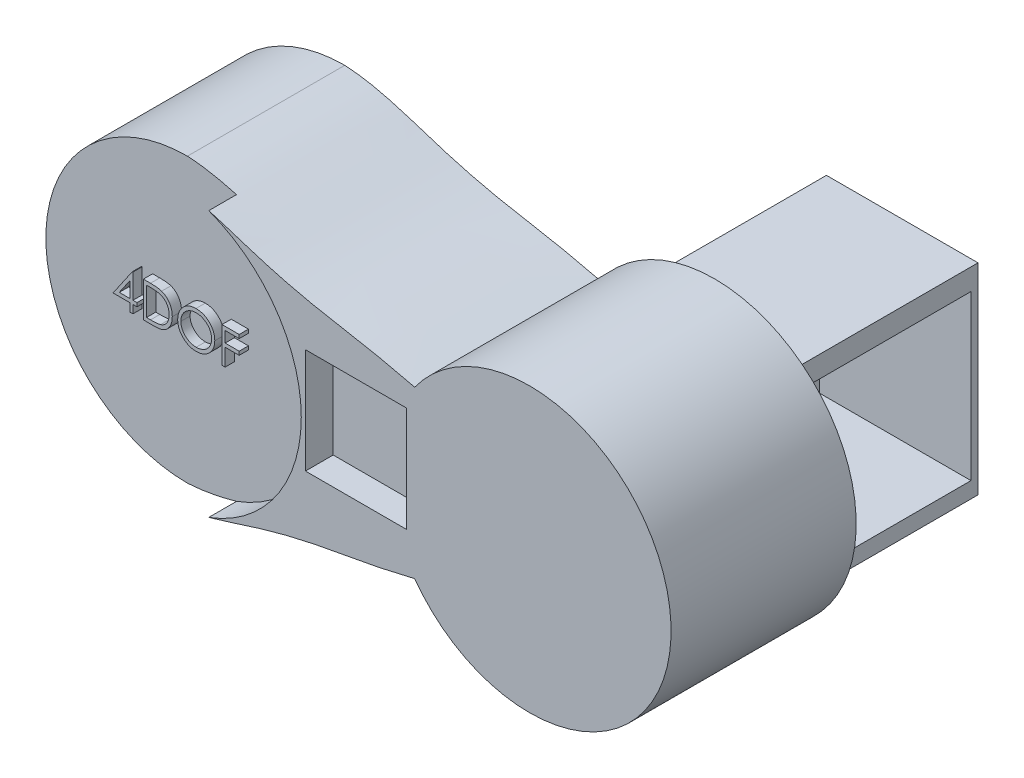
from build123d import *

# Parameters (mm, degrees)
BOSS_EXTRUDE1_DEPTH = 100
CUT_EXTRUDE1_DEPTH  = 39
CUT_EXTRUDE2_DEPTH  = 39
CUT_EXTRUDE3_START  = -15
SKETCH4_R           = 76.495
CUT_EXTRUDE3_DEPTH  = 15
SKETCH5_W           = 54.638275271
SKETCH5_H           = 56.789388471
CUT_EXTRUDE4_DEPTH  = 15
FILLET4_R           = 10
SKETCH6_R           = 74.995169826
CUT_EXTRUDE5_DEPTH  = 39
BOSS_EXTRUDE2_DEPTH = 5
SKETCH8_W           = 81.869075924
SKETCH8_H           = 108.586115143
BOSS_EXTRUDE4_DEPTH = 95
SKETCH10_W          = 89.27039146
SKETCH10_H          = 88.452515612
CUT_EXTRUDE6_DEPTH  = 95
SKETCH11_R          = 5
BOSS_EXTRUDE5_DEPTH = 19
FILLET9_R           = 2
SKETCH12_W          = 89.27039146
SKETCH12_H          = 88.452515612
BOSS_EXTRUDE6_DEPTH = 5


with BuildPart() as part:
    # Sketch1 → Boss-Extrude1 (new body)
    with BuildSketch(Plane.XY):
        with BuildLine():
            ThreePointArc((0, 76.495), (-76.495, 0), (0, -76.495))
            add(Edge.make_bspline(
                [(0, -76.495), (18.845842649, -75.533581637), (46.07453922, -64.621127946), (86.232484293, -54.666992553), (114.479970356, -50.46710642), (132.028881686, -46.045929846), (137.759808345, -44.793841614)],
                knots=[0, 0, 0, 0, 0.273220276, 0.42957721, 0.608078275, 0.694263811, 0.694263811, 0.694263811, 0.694263811], degree=3))
            ThreePointArc((137.759808345, -44.793841614), (276.26284636, 0), (137.759808345, 44.793841614))
            add(Edge.make_bspline(
                [(0, 76.495), (18.845842649, 75.533581637), (46.07453922, 64.621127946), (86.232484293, 54.666992553), (114.479970356, 50.46710642), (132.028881686, 46.045929846), (137.759808345, 44.793841614)],
                knots=[0, 0, 0, 0, 0.273220276, 0.42957721, 0.608078275, 0.694263811, 0.694263811, 0.694263811, 0.694263811], degree=3))
        make_face()
    extrude(amount=BOSS_EXTRUDE1_DEPTH)

    # Sketch2 → Cut-Extrude1 (cut)
    with BuildSketch(Plane(origin=(0, 0, 0), x_dir=(-1, 0, 0), z_dir=(0, 0, -1))):
        Polygon((43.794178302, 54.250712275), (42.68497286, -31.742134307), (-43.307873722, -30.632928864), (-42.19866828, 55.359917718), align=None)
    extrude(amount=-CUT_EXTRUDE1_DEPTH, mode=Mode.SUBTRACT)

    # Sketch3 → Cut-Extrude2 (cut)
    with BuildSketch(Plane(origin=(0, 0, 39), x_dir=(-1, 0, 0), z_dir=(0, 0, -1))):
        with BuildLine():
            Line((6.136565093, 14.54253264), (10.031864242, 14.637529152))
            Line((10.031864242, 14.637529152), (10.153765373, 9.639015362))
            Line((10.153765373, 9.639015362), (6.258466225, 9.54401885))
            ThreePointArc((6.258466225, 9.54401885), (-6.377692603, 11.736598164), (6.136565093, 14.54253264))
        make_face()
    extrude(amount=-CUT_EXTRUDE2_DEPTH, mode=Mode.SUBTRACT)

    # Sketch4 → Cut-Extrude3 (cut)
    with BuildSketch(Plane.XY.offset(100).offset(CUT_EXTRUDE3_START)):
        Circle(SKETCH4_R)
    extrude(amount=CUT_EXTRUDE3_DEPTH, mode=Mode.SUBTRACT)

    # Sketch5 → Cut-Extrude4 (cut)
    with BuildSketch(Plane.XY.offset(100)):
        with Locations((106.056840553, 4.43582867)):
            Rectangle(SKETCH5_W, SKETCH5_H)
    extrude(amount=-CUT_EXTRUDE4_DEPTH, mode=Mode.SUBTRACT)

    # Fillet4
    fillet4_edges = [part.edges().sort_by_distance(p)[0] for p in [
        (133.375978188, 4.435828671, 85),
    ]]
    fillet(fillet4_edges, radius=FILLET4_R)

    # Sketch6 → Cut-Extrude5 (cut)
    with BuildSketch(Plane(origin=(0, 0, 39), x_dir=(-1, 0, 0), z_dir=(0, 0, -1))):
        Circle(SKETCH6_R)
    extrude(amount=CUT_EXTRUDE5_DEPTH, mode=Mode.SUBTRACT)

    # Sketch7 → Boss-Extrude2 (add)
    # profile 1 of 4: a face of its own
    with BuildSketch(Plane.XY.offset(85)):
        Polygon((-24.789715161, 12.540864383), (-24.442449536, 12.540864383), (-24.442449536, -0.647597156), (-22.244372613, -0.647597156), (-22.244372613, -2.601443309), (-24.442449536, -2.601443309), (-24.442449536, -6.997597156), (-26.152064921, -6.997597156), (-26.152064921, -2.601443309), (-35.188603382, -2.601443309), align=None)
        Polygon((-26.152064921, -0.647597156), (-26.152064921, 7.625720152), (-31.830430305, -0.647597156), align=None, mode=Mode.SUBTRACT)
    # profile 2 of 4: a face of its own
    with BuildSketch(Plane.XY.offset(85)):
        with BuildLine():
            Line((-18.825141844, -6.997597156), (-18.825141844, 12.052402844))
            Line((-18.825141844, 12.052402844), (-14.978507228, 12.052402844))
            add(Edge.make_bspline(
                [(-14.978507228, 12.052402844), (-14.643940307, 12.049993999), (-13.997558756, 12.045340123), (-13.06349672, 12.015832265), (-12.199259384, 11.96363273), (-11.407689109, 11.887598595), (-10.686612798, 11.794237083), (-10.038049516, 11.677213454), (-9.45864571, 11.539029269), (-9.102304898, 11.421216176), (-8.93379569, 11.365503806)],
                knots=[0, 0, 0, 0, 1.314313732, 2.53924729, 3.670748893, 4.714932338, 5.66265055, 6.526160246, 7.303039223, 8, 8, 8, 8], degree=3))
            add(Edge.make_bspline(
                [(-8.93379569, 11.365503806), (-8.713388609, 11.28151668), (-8.277572548, 11.115446976), (-7.657048067, 10.80217625), (-7.072891448, 10.447230654), (-6.521970102, 10.050142315), (-6.016868462, 9.59966779), (-5.537854052, 9.114942795), (-5.104522484, 8.578340544), (-4.707693044, 8.000989538), (-4.349903241, 7.389691082), (-4.038902967, 6.74560999), (-3.780617661, 6.072017186), (-3.566205956, 5.370785881), (-3.397224523, 4.640374167), (-3.281934294, 3.879931554), (-3.205892192, 3.092463394), (-3.198250142, 2.558113813), (-3.194372613, 2.286988181)],
                knots=[0, 0, 0, 0, 0.984719456, 1.947108742, 2.898477687, 3.838006223, 4.779231079, 5.722358779, 6.681677486, 7.655904652, 8.64651281, 9.637519902, 10.640069247, 11.656948941, 12.698408672, 13.768548281, 14.867775369, 16, 16, 16, 16], degree=3))
            add(Edge.make_bspline(
                [(-3.194372613, 2.286988181), (-3.197795993, 2.05152344), (-3.204542121, 1.587515575), (-3.265117398, 0.903670128), (-3.353162797, 0.240111976), (-3.489474788, -0.399999049), (-3.654951325, -1.022271206), (-3.867027634, -1.620072422), (-4.109972264, -2.198886584), (-4.393272317, -2.750887417), (-4.704284712, -3.273855486), (-5.0380502, -3.766845147), (-5.394212785, -4.222821711), (-5.77616873, -4.643166014), (-6.178982158, -5.027244376), (-6.6052903, -5.378265203), (-7.056193191, -5.689360165), (-7.529671268, -5.972753997), (-8.039537057, -6.219970504), (-8.595447985, -6.429139557), (-9.199774826, -6.602476135), (-9.85103422, -6.747097725), (-10.550351434, -6.861818472), (-11.298412091, -6.938706408), (-12.094066854, -6.990701656), (-12.640416854, -6.995254026), (-12.921626219, -6.997597156)],
                knots=[0, 0, 0, 0, 1.105936401, 2.179363191, 3.223086493, 4.248585256, 5.251745608, 6.245858792, 7.225916811, 8.198733463, 9.158002045, 10.082870192, 10.993790845, 11.873723703, 12.748670949, 13.606408763, 14.465103618, 15.319838547, 16.196477973, 17.123216899, 18.106603292, 19.147568657, 20.255746949, 21.433717677, 22.679120308, 24, 24, 24, 24], degree=3))
            Line((-12.921626219, -6.997597156), (-18.825141844, -6.997597156))
        make_face()
        with BuildLine():
            Line((-17.115526459, -5.043751002), (-14.928897853, -5.043751002))
            add(Edge.make_bspline(
                [(-14.928897853, -5.043751002), (-14.614690578, -5.042400649), (-14.010354918, -5.039803425), (-13.141359247, -5.017013076), (-12.347358532, -4.979773388), (-11.628240031, -4.927657607), (-10.98440977, -4.858704145), (-10.414522217, -4.781824317), (-9.920445454, -4.686043906), (-9.621472376, -4.599225113), (-9.483314921, -4.559105569)],
                knots=[0, 0, 0, 0, 1.375205317, 2.645023457, 3.804390687, 4.853969522, 5.800190428, 6.637939096, 7.370582563, 8, 8, 8, 8], degree=3))
            add(Edge.make_bspline(
                [(-9.483314921, -4.559105569), (-9.30942455, -4.497864945), (-8.965797176, -4.376846428), (-8.471144413, -4.156096872), (-8.009824144, -3.894610749), (-7.573796721, -3.603949801), (-7.169247354, -3.273862276), (-6.791381806, -2.911525894), (-6.440960859, -2.515096618), (-6.121604983, -2.085066481), (-5.835809785, -1.624112022), (-5.588316379, -1.136764942), (-5.371410186, -0.628365018), (-5.201165274, -0.091105168), (-5.067730452, 0.470211564), (-4.973216936, 1.055624667), (-4.914353936, 1.665024816), (-4.907488055, 2.079509949), (-4.903987998, 2.290804287)],
                knots=[0, 0, 0, 0, 0.998632004, 1.973411704, 2.929992603, 3.868527914, 4.809262121, 5.754881198, 6.702106254, 7.672490631, 8.653608572, 9.636854334, 10.631411391, 11.644891563, 12.686317036, 13.754757253, 14.855430412, 16, 16, 16, 16], degree=3))
            add(Edge.make_bspline(
                [(-4.903987998, 2.290804287), (-4.906781747, 2.513599372), (-4.912270094, 2.95128229), (-4.981254555, 3.593488789), (-5.082064735, 4.211147758), (-5.227844512, 4.804300507), (-5.41361401, 5.374104253), (-5.64545056, 5.917407587), (-5.910336016, 6.439948373), (-6.225495607, 6.929665992), (-6.570657622, 7.392815629), (-6.953714365, 7.817113098), (-7.368580032, 8.203524933), (-7.810729713, 8.558068906), (-8.292624496, 8.866481199), (-8.802912441, 9.142361563), (-9.349079595, 9.376490914), (-9.729060125, 9.501017296), (-9.922167084, 9.564301883)],
                knots=[0, 0, 0, 0, 1.122418816, 2.205001699, 3.251619955, 4.274784885, 5.280384055, 6.268708349, 7.249350384, 8.229342522, 9.199999885, 10.157847722, 11.105861043, 12.055065948, 13.010012805, 13.98527497, 14.976112212, 16, 16, 16, 16], degree=3))
            add(Edge.make_bspline(
                [(-9.922167084, 9.564301883), (-10.081921181, 9.60847844), (-10.421602222, 9.702409922), (-10.975899876, 9.804873735), (-11.599733761, 9.895249652), (-12.295873563, 9.971765551), (-13.063525747, 10.0266694), (-13.903280706, 10.067878984), (-14.815501411, 10.095673655), (-15.447866345, 10.097571619), (-15.776073334, 10.098556691)],
                knots=[0, 0, 0, 0, 0.674548936, 1.434276114, 2.292660221, 3.240891867, 4.284742987, 5.42552168, 6.663806718, 8, 8, 8, 8], degree=3))
            Line((-15.776073334, 10.098556691), (-17.115526459, 10.098556691))
            Line((-17.115526459, 10.098556691), (-17.115526459, -5.043751002))
        make_face(mode=Mode.SUBTRACT)
    # profile 3 of 4: a face of its own
    with BuildSketch(Plane.XY.offset(85)):
        with BuildLine():
            add(Edge.make_bspline(
                [(9.627742772, 12.540864383), (9.980484034, 12.531930045), (10.673296975, 12.514382269), (11.691518919, 12.380057434), (12.663586509, 12.147672526), (13.597418264, 11.838175435), (14.481844322, 11.425310852), (15.323521723, 10.926281687), (16.120447851, 10.335859819), (16.86188137, 9.658609313), (17.540371342, 8.921736514), (18.138137952, 8.135363889), (18.639111008, 7.304246122), (19.050513649, 6.430880744), (19.373267511, 5.517242918), (19.59598402, 4.558461846), (19.738250237, 3.560749719), (19.754882397, 2.880246355), (19.763319695, 2.535035056)],
                knots=[0, 0, 0, 0, 1.065120563, 2.091984664, 3.0946048, 4.079830382, 5.057816894, 6.036188127, 7.030412546, 8.04752943, 9.064399622, 10.05169764, 11.02544977, 11.989514704, 12.962713494, 13.945757189, 14.957906945, 16, 16, 16, 16], degree=3))
            add(Edge.make_bspline(
                [(19.763319695, 2.535035056), (19.754883633, 2.192366669), (19.738255179, 1.516927581), (19.595822262, 0.525546835), (19.372441962, -0.427446813), (19.053510856, -1.340462437), (18.644069323, -2.214463177), (18.139760463, -3.047149312), (17.545720444, -3.838793825), (16.869680298, -4.580724188), (16.132711769, -5.261067564), (15.342244174, -5.853897445), (14.516054819, -6.364024466), (13.643511979, -6.77106132), (12.736187493, -7.096391344), (11.785960848, -7.318202088), (10.797284604, -7.461278709), (10.123072426, -7.47770806), (9.780387002, -7.486058694)],
                knots=[0, 0, 0, 0, 1.043624062, 2.057103931, 3.04512605, 4.022047818, 4.998200453, 5.980619268, 6.982898556, 8.009068085, 9.034988726, 10.034168286, 11.015286542, 11.987931943, 12.962482838, 13.94673481, 14.956375938, 16, 16, 16, 16], degree=3))
            add(Edge.make_bspline(
                [(9.780387002, -7.486058694), (9.435177495, -7.477625603), (8.754677662, -7.461001735), (7.755711798, -7.318500089), (6.796257221, -7.095662421), (5.879057681, -6.777203918), (5.003601707, -6.365630134), (4.168177114, -5.86377487), (3.376137184, -5.268287431), (2.634048535, -4.592466503), (1.955056471, -3.856747056), (1.363094726, -3.068434896), (0.861126609, -2.242995911), (0.450934757, -1.378139387), (0.126189628, -0.478046248), (-0.095360882, 0.463287608), (-0.238703707, 1.440495489), (-0.255221943, 2.105846122), (-0.263603382, 2.443448518)],
                knots=[0, 0, 0, 0, 1.053102029, 2.075944431, 3.073151272, 4.055350789, 5.033113405, 6.020478099, 7.024410459, 8.052272461, 9.079885166, 10.07527673, 11.055994387, 12.023226415, 12.992069828, 13.970394897, 14.97016774, 16, 16, 16, 16], degree=3))
            add(Edge.make_bspline(
                [(-0.263603382, 2.443448518), (-0.260693437, 2.670049188), (-0.254910258, 3.12039186), (-0.185286904, 3.789137213), (-0.084258216, 4.447127793), (0.060532194, 5.092492524), (0.249898267, 5.723651598), (0.473338588, 6.344957893), (0.746242603, 6.950115018), (1.054747273, 7.541989764), (1.399072257, 8.111355651), (1.779395979, 8.649543097), (2.182359913, 9.161068236), (2.62412067, 9.6326755), (3.09011875, 10.078084401), (3.587913637, 10.490450047), (4.114467852, 10.873490851), (4.672047091, 11.218678708), (5.246912273, 11.530876283), (5.83951302, 11.798783787), (6.441800931, 12.028723064), (7.056596943, 12.215090984), (7.68226846, 12.362222494), (8.32018103, 12.462411091), (8.96982645, 12.532212021), (9.407493772, 12.537967853), (9.627742772, 12.540864383)],
                knots=[0, 0, 0, 0, 1.037015668, 2.060948919, 3.074880161, 4.083647147, 5.086022904, 6.090072063, 7.104153813, 8.122640571, 9.144368836, 10.147691507, 11.138137339, 12.123020368, 13.103399296, 14.087645067, 15.080126199, 16.082011238, 17.087798457, 18.072939717, 19.057185487, 20.037253025, 21.01195951, 21.997135196, 22.992090687, 24, 24, 24, 24], degree=3))
        make_face()
        with BuildLine():
            add(Edge.make_bspline(
                [(9.711697099, 10.587018229), (9.530914593, 10.584814469), (9.171077875, 10.580428018), (8.636129185, 10.522648194), (8.108215945, 10.44029837), (7.587229131, 10.322833236), (7.075348613, 10.162791177), (6.567803049, 9.978599948), (6.069220713, 9.754239441), (5.581247573, 9.500750864), (5.108181235, 9.220177452), (4.661797817, 8.910088263), (4.240941712, 8.577755275), (3.846643361, 8.222402903), (3.480060552, 7.842221499), (3.133978106, 7.442974668), (2.822267954, 7.013250804), (2.536596457, 6.564702732), (2.280957212, 6.097914698), (2.053634353, 5.617801019), (1.867684534, 5.120445324), (1.7160336, 4.611243409), (1.59030463, 4.091001735), (1.510654271, 3.555773758), (1.452239572, 3.008248934), (1.448103842, 2.638233414), (1.446012002, 2.451080729)],
                knots=[0, 0, 0, 0, 1.008559885, 2.007477868, 2.99961109, 3.989939068, 4.984837346, 5.991145699, 7.001802488, 8.033829008, 9.059044045, 10.069351652, 11.065060232, 12.050310815, 13.029377138, 14.011219647, 14.996725999, 15.989392538, 16.977580475, 17.965360261, 18.951710183, 19.937753436, 20.929683414, 21.935841486, 22.955955122, 24, 24, 24, 24], degree=3))
            add(Edge.make_bspline(
                [(1.446012002, 2.451080729), (1.452950894, 2.175877784), (1.46660184, 1.634468455), (1.586113758, 0.841073272), (1.770201933, 0.078592742), (2.041568456, -0.648801078), (2.380933944, -1.347360675), (2.800180304, -2.010889073), (3.29689047, -2.639565604), (3.861116236, -3.229001282), (4.477915539, -3.767004874), (5.132869398, -4.239245712), (5.818961176, -4.638807215), (6.537980036, -4.96431768), (7.286087356, -5.222253253), (8.068103741, -5.399029802), (8.878819813, -5.515373352), (9.431436665, -5.526546209), (9.711697099, -5.53221254)],
                knots=[0, 0, 0, 0, 1.032063989, 2.030389145, 3.003944642, 3.970395727, 4.937377036, 5.913328081, 6.909231446, 7.93887556, 8.970685674, 9.976071282, 10.964166581, 11.944589148, 12.933237628, 13.927779006, 14.949070134, 16, 16, 16, 16], degree=3))
            add(Edge.make_bspline(
                [(9.711697099, -5.53221254), (9.900071672, -5.529624438), (10.273675027, -5.524491454), (10.82936637, -5.472791512), (11.375046608, -5.389886623), (11.90995036, -5.270521198), (12.433470548, -5.121129974), (12.947792262, -4.943650769), (13.447437242, -4.722228789), (13.938708645, -4.47758351), (14.408951046, -4.198690652), (14.857853586, -3.899125866), (15.274101419, -3.567282374), (15.668104794, -3.217209708), (16.036192644, -2.841849336), (16.375875829, -2.441689272), (16.686010549, -2.014203694), (16.971573568, -1.566335986), (17.226317041, -1.098270668), (17.448271852, -0.616416278), (17.636573568, -0.121959325), (17.78858443, 0.385813371), (17.907703871, 0.905937419), (17.989781721, 1.439109244), (18.047195366, 1.984262237), (18.051522857, 2.352982368), (18.05370431, 2.538851162)],
                knots=[0, 0, 0, 0, 1.047197238, 2.076906641, 3.100256066, 4.114471768, 5.12198147, 6.126382909, 7.136867548, 8.15857795, 9.17633901, 10.174870724, 11.156907918, 12.133735059, 13.104061851, 14.077631395, 15.04955518, 16.038496417, 17.029181396, 18.010275684, 18.986308667, 19.968651475, 20.955262928, 21.950658345, 22.966943676, 24, 24, 24, 24], degree=3))
            add(Edge.make_bspline(
                [(18.05370431, 2.538851162), (18.05152111, 2.723448406), (18.047190329, 3.089631045), (17.989809146, 3.630982071), (17.907617157, 4.160317408), (17.789165846, 4.675558964), (17.636492866, 5.176838079), (17.448238968, 5.663683949), (17.226250409, 6.137910268), (16.971479931, 6.598344941), (16.68509952, 7.040167444), (16.372166567, 7.462546289), (16.02727803, 7.857549352), (15.660287808, 8.234928187), (15.262029133, 8.586634129), (14.834306046, 8.912783849), (14.382311172, 9.221248385), (13.90373579, 9.499517514), (13.409829413, 9.756497838), (12.903023442, 9.976666869), (12.389059343, 10.163749405), (11.869244103, 10.323317457), (11.339202464, 10.439838307), (10.802515909, 10.522722407), (10.259926959, 10.580407907), (9.895020292, 10.584807796), (9.711697099, 10.587018229)],
                knots=[0, 0, 0, 0, 1.02996197, 2.043119294, 3.035359645, 4.018872909, 4.991431989, 5.957985074, 6.929999688, 7.912076566, 8.892894881, 9.867085534, 10.843653904, 11.817741046, 12.803660682, 13.806313499, 14.818574707, 15.856120519, 16.894564902, 17.924820532, 18.937903209, 19.946497019, 20.957711757, 21.963978472, 22.977135795, 24, 24, 24, 24], degree=3))
        make_face(mode=Mode.SUBTRACT)
    # profile 4 of 4: a face of its own
    with BuildSketch(Plane.XY.offset(85)):
        Polygon((23.671012002, 12.052402844), (32.951781233, 12.052402844), (32.951781233, 10.098556691), (25.380627387, 10.098556691), (25.380627387, 4.237018229), (32.951781233, 4.237018229), (32.951781233, 2.283172075), (25.380627387, 2.283172075), (25.380627387, -6.997597156), (23.671012002, -6.997597156), align=None)
    extrude(amount=BOSS_EXTRUDE2_DEPTH)

    # Sketch8 → Boss-Extrude4 (add)
    with BuildSketch(Plane(origin=(0, 0, 0), x_dir=(-1, 0, 0), z_dir=(0, 0, -1))):
        with Locations((-206.129367927, 5.828218014)):
            Rectangle(SKETCH8_W, SKETCH8_H)
    extrude(amount=BOSS_EXTRUDE4_DEPTH)

    # Sketch10 → Cut-Extrude6 (cut)
    with BuildSketch(Plane.ZY.offset(-165.194829965)):
        with Locations((-46.574600508, 4.356924486)):
            Rectangle(SKETCH10_W, SKETCH10_H)
    extrude(amount=-CUT_EXTRUDE6_DEPTH, mode=Mode.SUBTRACT)

    # Sketch11 → Boss-Extrude5 (add)
    with BuildSketch(Plane(origin=(0, 0, -95), x_dir=(-1, 0, 0), z_dir=(0, 0, -1))):
        with Locations((-208.384491251, 6.09415879)):
            Circle(SKETCH11_R)
        with Locations((-208.384491251, 35.760410019)):
            Circle(SKETCH11_R)
        with Locations((-208.384491251, -23.271539943)):
            Circle(SKETCH11_R)
    extrude(amount=BOSS_EXTRUDE5_DEPTH)

    # Fillet9
    fillet9_edges = [part.edges().sort_by_distance(p)[0] for p in [
        (213.384491251, 6.09415879, -114),
        (213.384491251, 35.760410019, -114),
        (213.384491251, -23.271539943, -114),
    ]]
    fillet(fillet9_edges, radius=FILLET9_R)


with BuildPart() as body_2:
    # Sketch12 → Boss-Extrude6 (new body)
    with BuildSketch(Plane.ZY.offset(-165.194829965)):
        with Locations((-46.574600508, 4.356924486)):
            Rectangle(SKETCH12_W, SKETCH12_H)
    extrude(amount=BOSS_EXTRUDE6_DEPTH)


solid = Compound([part.part, body_2.part])
